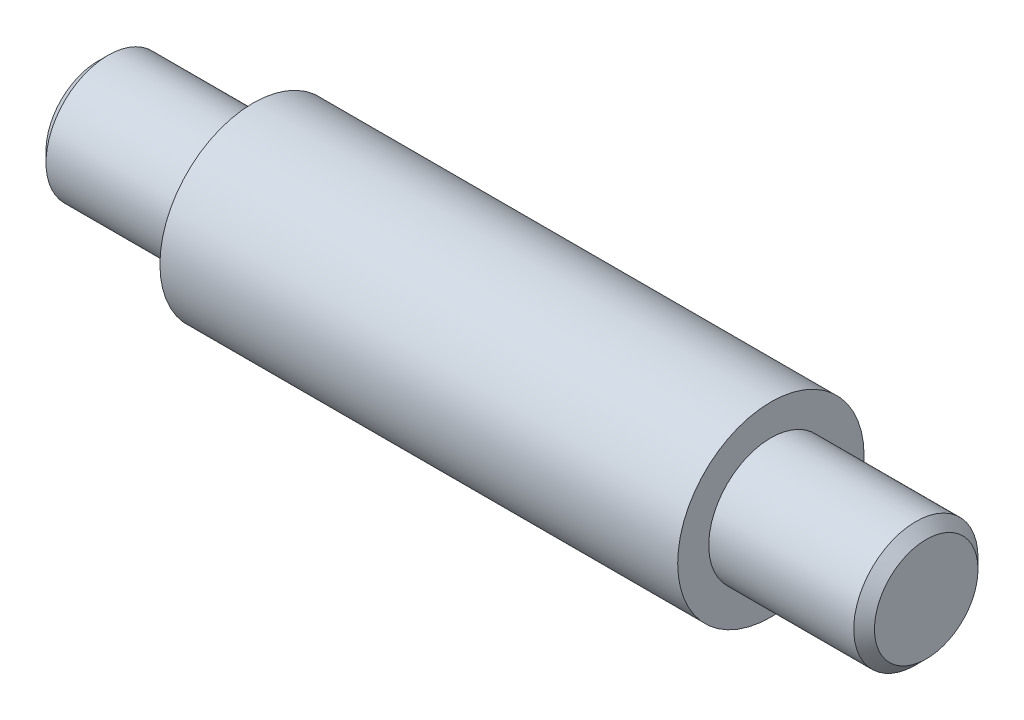
from build123d import *


with BuildPart() as part:
    # Sketch2 → Revolve1 (revolve)
    with BuildSketch(Plane.XY, mode=Mode.PRIVATE) as revolve1_sk:
        Polygon((0, 0), (0, 5), (1, 6), (15, 6), (15, 9), (65, 9), (65, 6), (79, 6), (80, 5), (80, 0), align=None)
    revolve(revolve1_sk.sketch.rotate(Axis((80, 0, 0), (-1, 0, 0)), 90), axis=Axis((80, 0, 0), (-1, 0, 0)))


solid = part.part
